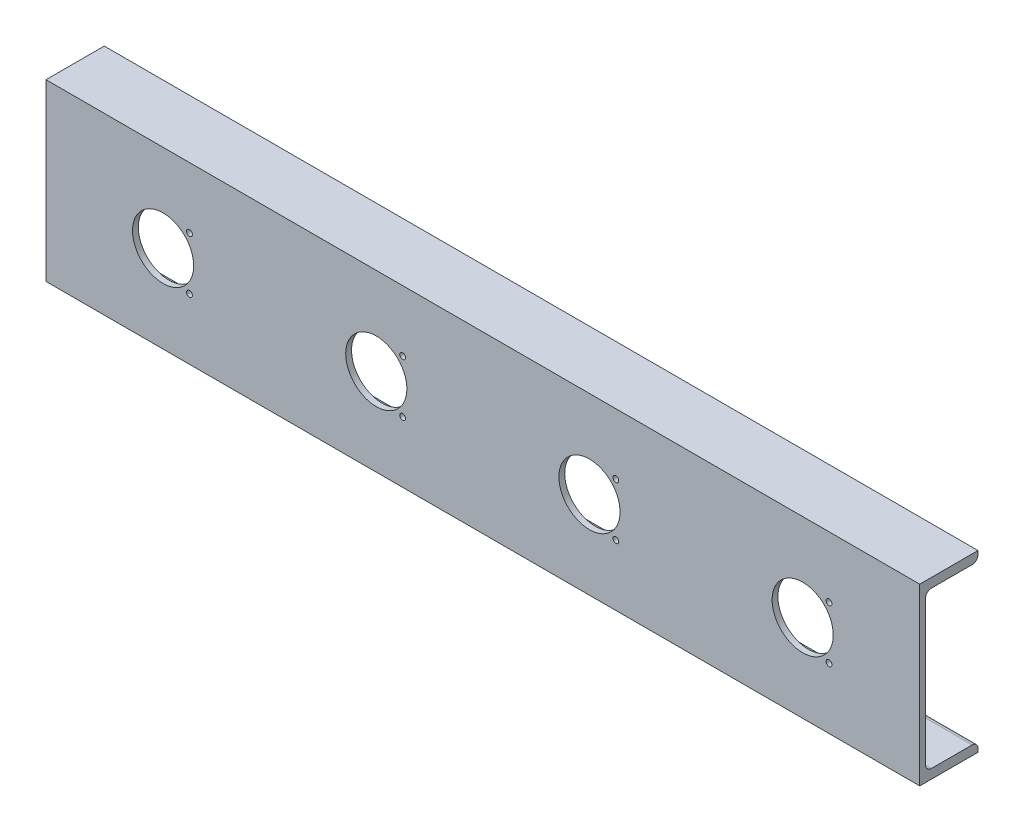
from build123d import *

# Parameters (mm, degrees)
BOSS_EXTRUDE1_DEPTH = 1500
SKETCH5_R           = 52.5
CUT_EXTRUDE3_DEPTH  = 30
LPATTERN2_COUNT     = 4
LPATTERN2_PITCH     = 366
SKETCH6_R           = 5
CUT_EXTRUDE4_DEPTH  = 1515.807183702
LPATTERN3_COUNT     = 4
LPATTERN3_PITCH     = 366


with BuildPart() as part:
    # Sketch1 → Boss-Extrude1 (new body)
    with BuildSketch(Plane(origin=(0, 0, 0), x_dir=(0, 0, -1), z_dir=(1, 0, 0))):
        with BuildLine():
            Line((-86.622073579, 113.879598662), (-186.622073579, 113.879598662))
            Line((-186.622073579, 113.879598662), (-186.622073579, -186.120401338))
            Line((-186.622073579, -186.120401338), (-86.622073579, -186.120401338))
            Line((-86.622073579, -186.120401338), (-86.622073579, -180.120401338))
            ThreePointArc((-86.622073579, -180.120401338), (-89.551005767, -173.049333526), (-96.622073579, -170.120401338))
            Line((-96.622073579, -170.120401338), (-166.622073579, -170.120401338))
            ThreePointArc((-166.622073579, -170.120401338), (-173.69314139, -167.19146915), (-176.622073579, -160.120401338))
            Line((-176.622073579, -160.120401338), (-176.622073579, 87.879598662))
            ThreePointArc((-176.622073579, 87.879598662), (-173.69314139, 94.950666474), (-166.622073579, 97.879598662))
            Line((-166.622073579, 97.879598662), (-96.622073579, 97.879598662))
            ThreePointArc((-96.622073579, 97.879598662), (-89.551005767, 100.80853085), (-86.622073579, 107.879598662))
            Line((-86.622073579, 107.879598662), (-86.622073579, 113.879598662))
        make_face()
    extrude(amount=BOSS_EXTRUDE1_DEPTH)

    # Sketch5 → Cut-Extrude3 (cut)
    with BuildSketch(Plane(origin=(0, 0, 176.622073579), x_dir=(-1, 0, 0), z_dir=(0, 0, -1))):
        with Locations(Location((-1299, -36.120401338, 0), (0, 0, 90))):
            Circle(SKETCH5_R)
    cut_extrude3 = extrude(amount=-CUT_EXTRUDE3_DEPTH, mode=Mode.SUBTRACT)

    # LPattern2: Cut-Extrude3 ×4
    with Locations(*[(-i * LPATTERN2_PITCH, 0, 0) for i in range(1, LPATTERN2_COUNT)]):
        add(cut_extrude3, mode=Mode.SUBTRACT)

    # Sketch6 → Cut-Extrude4 (cut, symmetric)
    with BuildSketch(Plane.XY.offset(186.622073579)):
        with Locations(Location((1344.254833996, 9.134432658, 0), (0, 0, 270))):
            Circle(SKETCH6_R)
        with Locations(Location((1344.254833996, -81.375235334, 0), (0, 0, 270))):
            Circle(SKETCH6_R)
    cut_extrude4 = extrude(amount=CUT_EXTRUDE4_DEPTH, both=True, mode=Mode.SUBTRACT)

    # LPattern3: Cut-Extrude4 ×4
    with Locations(*[(-i * LPATTERN3_PITCH, 0, 0) for i in range(1, LPATTERN3_COUNT)]):
        add(cut_extrude4, mode=Mode.SUBTRACT)


solid = part.part
